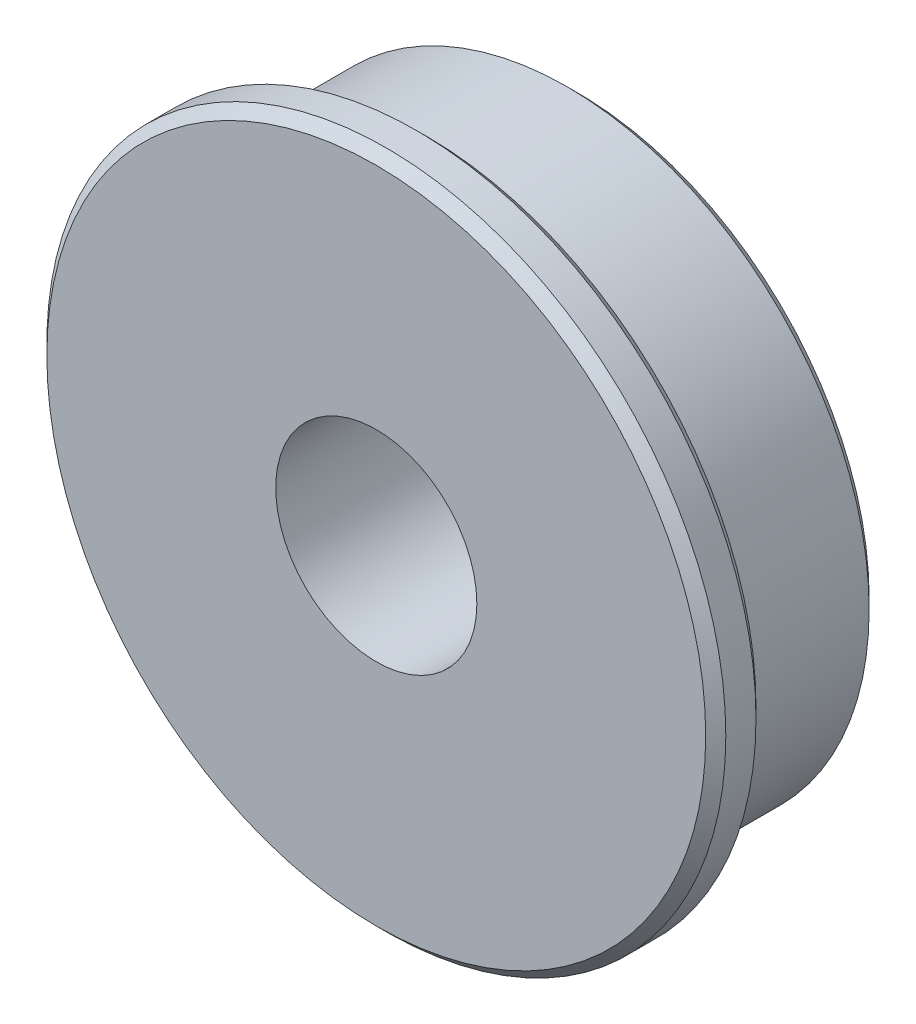
from build123d import *

# Parameters (mm, degrees)
SKETCH_1_R      = 6
SKETCH_1_R_2    = 2
EXTRUDE_1_DEPTH = 2
EXTRUDE_START   = -1
SKETCH_2_R      = 6.75
SKETCH_2_R_2    = 2
EXTRUDE_2_DEPTH = 1
CHAMFER_1_SIZE  = 0.2


with BuildPart() as part:
    # 草图1 → 凸台-拉伸1 (new, symmetric)
    with BuildSketch(Plane.XY):
        Circle(SKETCH_1_R)
        Circle(SKETCH_1_R_2, mode=Mode.SUBTRACT)
    extrude(amount=EXTRUDE_1_DEPTH, both=True)

    # 草图2 → 凸台-拉伸2 (add)
    with BuildSketch(Plane.XY.offset(2).offset(EXTRUDE_START)):
        Circle(SKETCH_2_R)
        Circle(SKETCH_2_R_2, mode=Mode.SUBTRACT)
    extrude(amount=EXTRUDE_2_DEPTH)

    # 倒角1
    chamfer_1_edges = [part.edges().sort_by_distance(p)[0] for p in [
        (-6.75, 0, 2),
        (-6.75, 0, 1),
        (-6, 0, -2),
    ]]
    chamfer(chamfer_1_edges, length=CHAMFER_1_SIZE)


solid = part.part
